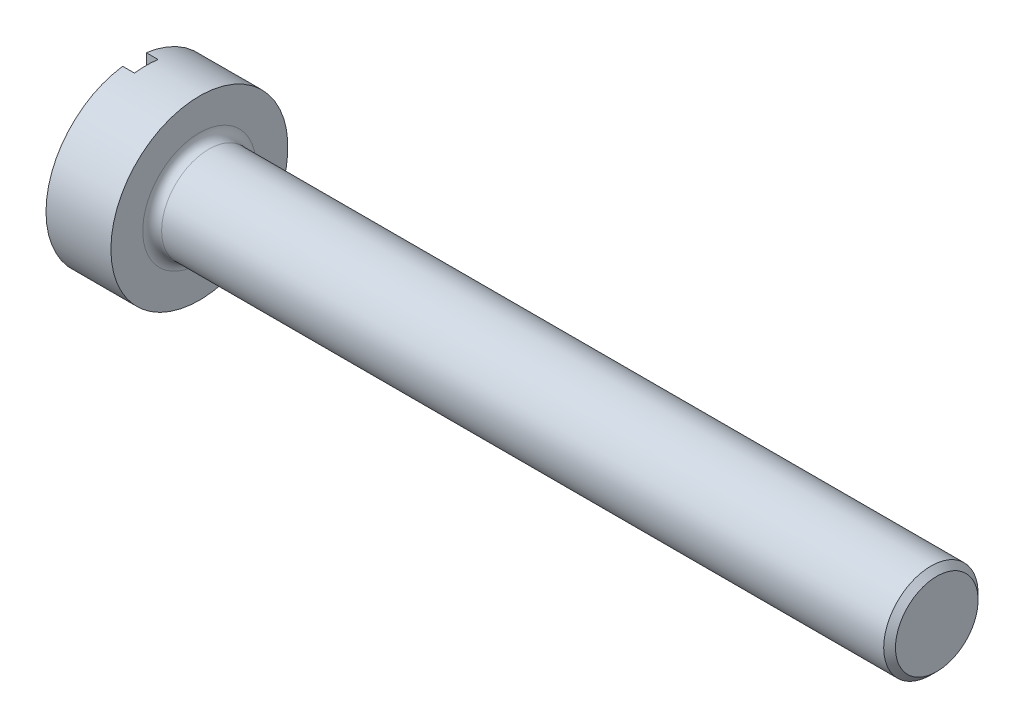
from build123d import *

# Parameters (mm, degrees)
SKETCH1_W           = 12.5
SKETCH1_H           = 0.8
CHAMFER1_SIZE       = 0.1
FILLET1_R           = 0.16
EXTRUDE1_DEPTH      = 14.764446956
EXTRUDE1_DEPTH_BACK = 14.764446956
SKETCH2_W           = 0.2
SKETCH2_H           = 0.2


with BuildPart() as part:
    # Sketch1 → Revolve1 (revolve)
    with BuildSketch(Plane.XY, mode=Mode.PRIVATE) as revolve1_sk:
        Polygon((0, 1.5), (0, 0), (1.1, 0), (1.1, 0.8), (1.1, 1.5), align=None)
        with Locations((7.35, 0.4)):
            Rectangle(SKETCH1_W, SKETCH1_H)
    revolve(revolve1_sk.sketch.rotate(Axis((0, 0, 0), (1, 0, 0)), 90), axis=Axis((0, 0, 0), (1, 0, 0)))

    # Chamfer1
    chamfer1_edges = [part.edges().sort_by_distance(p)[0] for p in [
        (13.6, 0, -0.8),
    ]]
    chamfer(chamfer1_edges, length=CHAMFER1_SIZE)

    # Fillet1
    fillet1_edges = [part.edges().sort_by_distance(p)[0] for p in [
        (1.1, 0, -0.8),
    ]]
    fillet(fillet1_edges, radius=FILLET1_R)

    # Sketch2 → Extrude1 (cut, two sides: drawn at the far end of the back side and taken through both)
    with BuildSketch(Plane(origin=(0, 0, 0), x_dir=(1, 0, 0), z_dir=(0, 1, 0)).offset(-EXTRUDE1_DEPTH_BACK)):
        with Locations((0.1, -0.1)):
            Rectangle(SKETCH2_W, SKETCH2_H)
        with Locations((0.1, 0.1)):
            Rectangle(SKETCH2_W, SKETCH2_H)
    extrude(amount=EXTRUDE1_DEPTH + EXTRUDE1_DEPTH_BACK, mode=Mode.SUBTRACT)


solid = part.part
